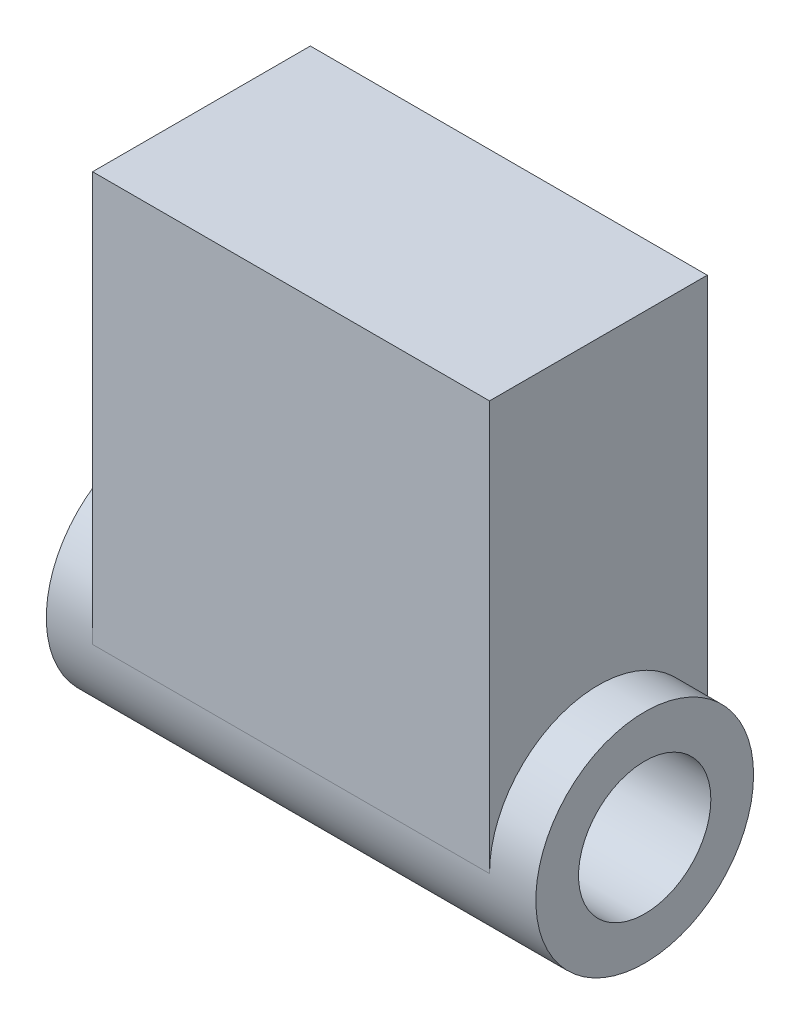
from build123d import *

# Parameters (mm, degrees)
SKETCH_1_R      = 2
EXTRUDE_1_DEPTH = 7.4
EXTRUDE_2_DEPTH = 6


with BuildPart() as part:
    # 스케치1 → 보스-돌출1 (new, symmetric)
    with BuildSketch(Plane(origin=(0, 0, 0), x_dir=(0, 0, -1), z_dir=(1, 0, 0))):
        with BuildLine():
            ThreePointArc((3.291358074, 0), (0, 3.291358074), (-3.291358074, 0))
            ThreePointArc((-3.291358074, 0), (0, -3.291358074), (3.291358074, 0))
        make_face()
        Circle(SKETCH_1_R, mode=Mode.SUBTRACT)
    extrude(amount=EXTRUDE_1_DEPTH, both=True)

    # 스케치1<3> → 보스-돌출2 (add, symmetric)
    with BuildSketch(Plane(origin=(0, 0, 0), x_dir=(0, 0, -1), z_dir=(1, 0, 0))):
        with BuildLine():
            Line((-3.291358074, 12.376548109), (-3.291358074, 0))
            ThreePointArc((-3.291358074, 0), (0, 3.291358074), (3.291358074, 0))
            Line((3.291358074, 0), (3.291358074, 12.376548109))
            Line((3.291358074, 12.376548109), (-3.291358074, 12.376548109))
        make_face()
    extrude(amount=EXTRUDE_2_DEPTH, both=True)


solid = part.part
